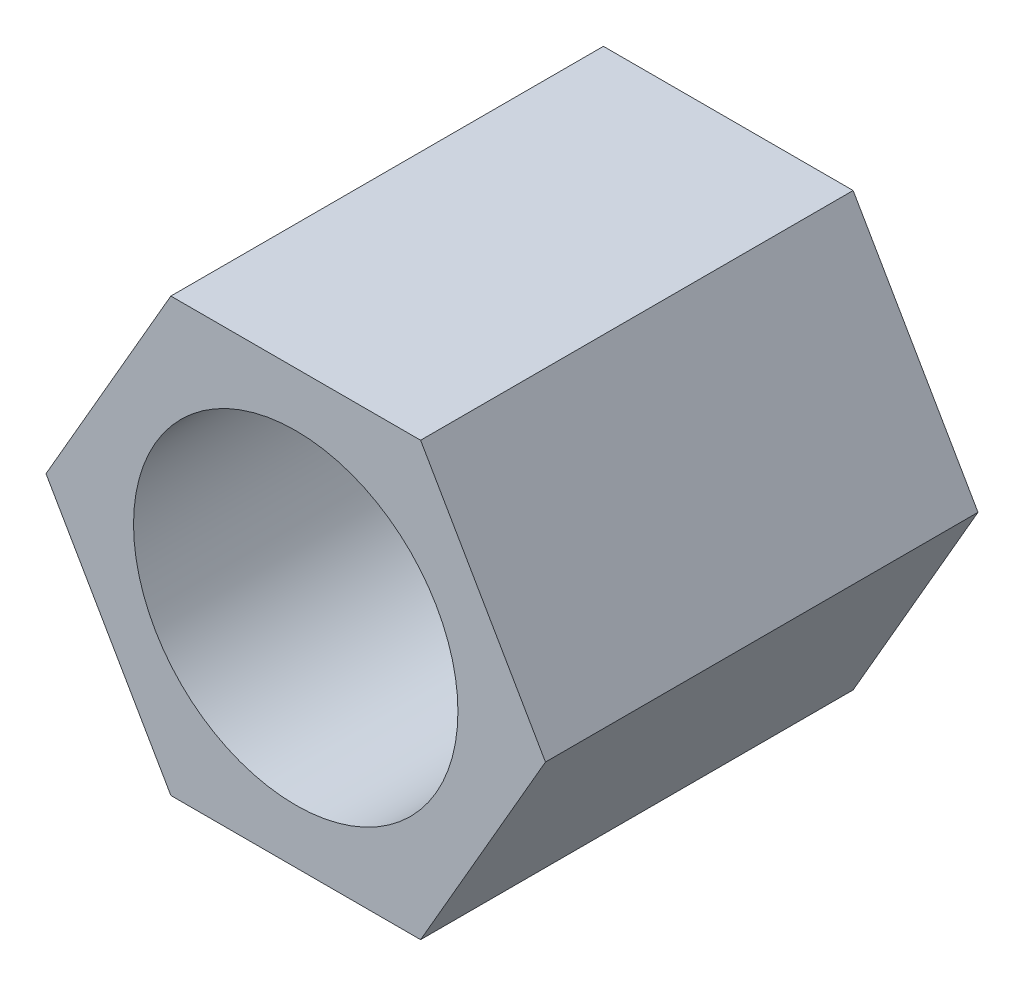
from build123d import *

# Parameters (mm, degrees)
SKETCH_1_R      = 1.5
EXTRUDE_1_DEPTH = 4


with BuildPart() as part:
    # 草图1 → 凸台-拉伸1 (new body)
    with BuildSketch(Plane.XY):
        Polygon((2.309401077, 0), (1.154700538, 2), (-1.154700538, 2), (-2.309401077, 0), (-1.154700538, -2), (1.154700538, -2), align=None)
        Circle(SKETCH_1_R, mode=Mode.SUBTRACT)
    extrude(amount=EXTRUDE_1_DEPTH)


solid = part.part
